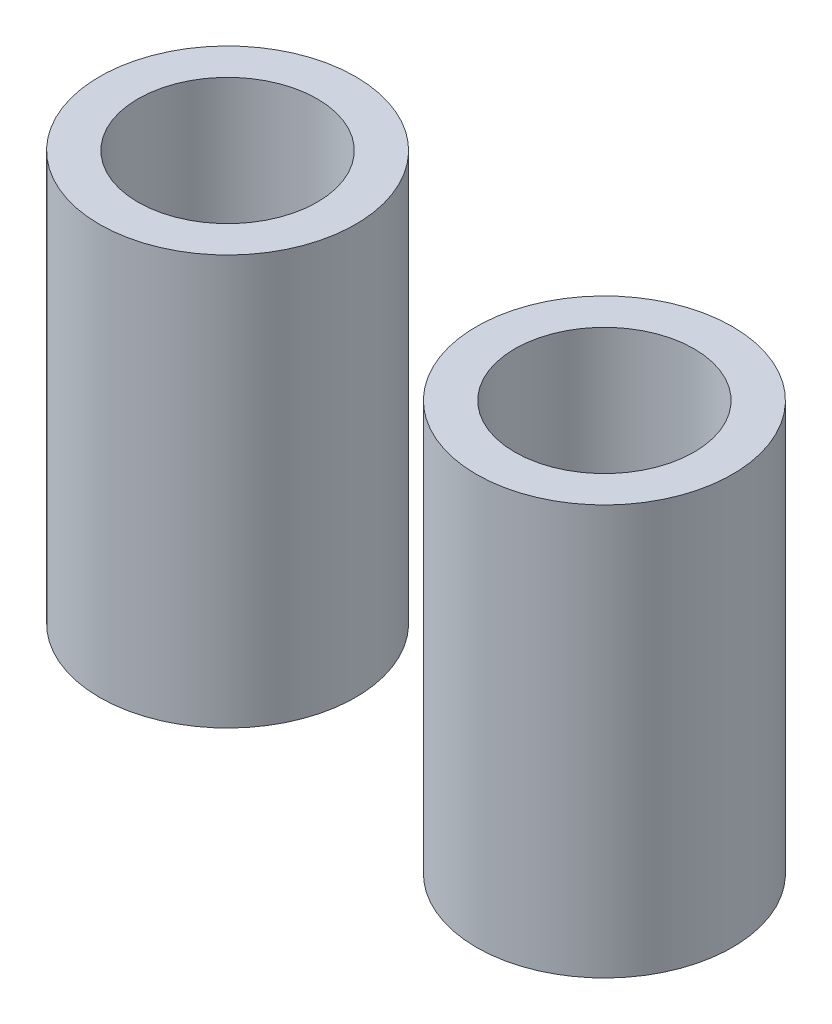
from build123d import *

# Parameters (mm, degrees)
SKETCH1_R           = 2.5
SKETCH1_R_2         = 1.75
BOSS_EXTRUDE1_DEPTH = 8
SKETCH2_R           = 2.5
SKETCH2_R_2         = 1.75
BOSS_EXTRUDE2_DEPTH = 8


with BuildPart() as part:
    # Sketch1 → Boss-Extrude1 (new body)
    with BuildSketch(Plane(origin=(0, 0, 0), x_dir=(1, 0, 0), z_dir=(0, 1, 0))):
        with Locations(Location((0, 0, 0), (0, 0, 270))):
            Circle(SKETCH1_R)
        with Locations(Location((0, 0, 0), (0, 0, 270))):
            Circle(SKETCH1_R_2, mode=Mode.SUBTRACT)
    extrude(amount=BOSS_EXTRUDE1_DEPTH)


with BuildPart() as body_2:
    # Sketch2 → Boss-Extrude2 (new body)
    with BuildSketch(Plane(origin=(0, 0, 0), x_dir=(1, 0, 0), z_dir=(0, 1, 0))):
        with Locations(Location((7.906825371, -0.547727598, 0), (0, 0, 270))):
            Circle(SKETCH2_R)
        with Locations(Location((7.906825371, -0.547727598, 0), (0, 0, 270))):
            Circle(SKETCH2_R_2, mode=Mode.SUBTRACT)
    extrude(amount=BOSS_EXTRUDE2_DEPTH)


solid = Compound([part.part, body_2.part])
